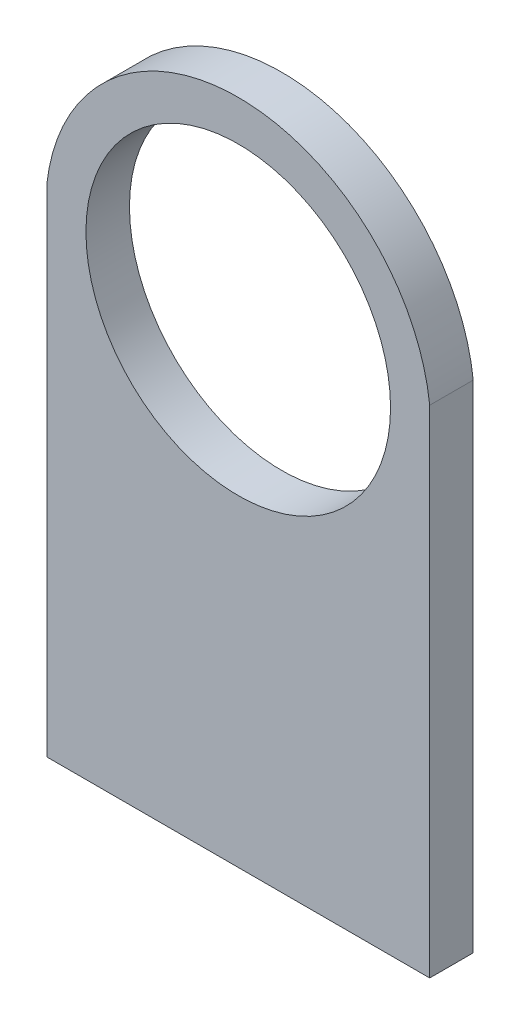
from build123d import *

# Parameters (mm, degrees)
ESQUISSE1_R        = 17.5
BOSS_EXTRU_1_DEPTH = 5


with BuildPart() as part:
    # Esquisse1 → Boss.-Extru.1 (new body)
    with BuildSketch(Plane.XY):
        with BuildLine():
            Line((0, 0), (0, -57))
            Line((0, -57), (44, -57))
            Line((44, -57), (44, 0))
            ThreePointArc((44, 0), (22, 19.641589825), (0, 0))
        make_face()
        with Locations((22, -2.5)):
            Circle(ESQUISSE1_R, mode=Mode.SUBTRACT)
    extrude(amount=BOSS_EXTRU_1_DEPTH)


solid = part.part
